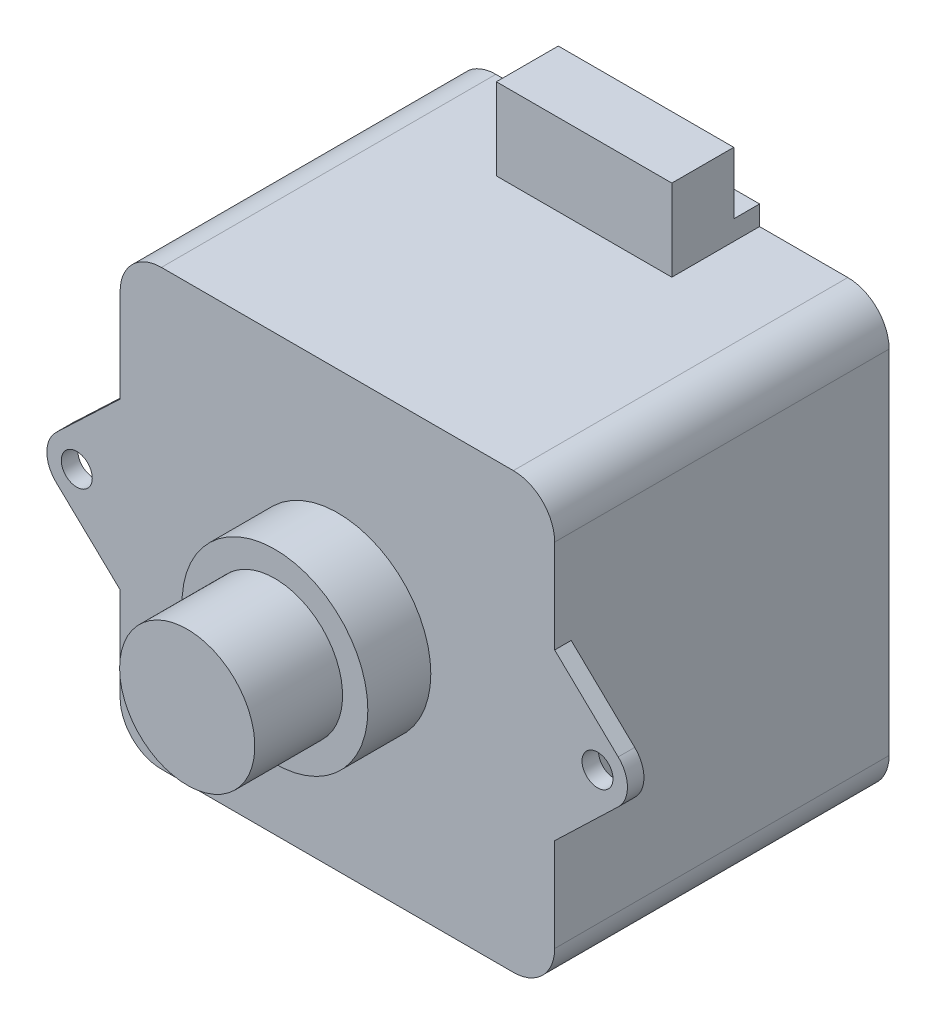
from build123d import *

# Parameters (mm, degrees)
SKETCH1_W           = 42.1
SKETCH1_H           = 42.1
BOSS_EXTRUDE1_DEPTH = 32.4
SKETCH2_W           = 17
SKETCH2_H           = 8.5
BOSS_EXTRUDE2_DEPTH = 7.9
BOSS_EXTRUDE3_DEPTH = 7.15
BOSS_EXTRUDE4_DEPTH = 7.2
SKETCH6_R           = 1.5
CUT_EXTRUDE1_DEPTH  = 7.2
CUT_EXTRUDE2_DEPTH  = 7.2
SKETCH9_R           = 6.55
BOSS_EXTRUDE5_DEPTH = 14.6
SKETCH11_R          = 9
BOSS_EXTRUDE6_DEPTH = 6.1
SKETCH12_W          = 17
SKETCH12_H          = 2.5
CUT_EXTRUDE3_DEPTH  = 6
CUT_EXTRUDE4_DEPTH  = 40


with BuildPart() as part:
    # Sketch1 → Boss-Extrude1 (new body)
    with BuildSketch(Plane.XY):
        with Locations((-21.05, 21.05)):
            Rectangle(SKETCH1_W, SKETCH1_H)
    extrude(amount=BOSS_EXTRUDE1_DEPTH)

    # Sketch2 → Boss-Extrude2 (add)
    with BuildSketch(Plane(origin=(0, 42.1, 0), x_dir=(1, 0, 0), z_dir=(0, 1, 0))):
        with Locations((-21.05, -4.25)):
            Rectangle(SKETCH2_W, SKETCH2_H)
    extrude(amount=BOSS_EXTRUDE2_DEPTH)

    # Sketch3 → Boss-Extrude3 (add)
    with BuildSketch(Plane(origin=(0, 0, 0), x_dir=(0, 0, -1), z_dir=(1, 0, 0))):
        Polygon((-32.4, 21.05), (-32.4, 29.05), (-30.8, 29.05), (-30.8, 21.05), (-30.8, 13.05), (-32.4, 13.05), align=None)
    extrude(amount=BOSS_EXTRUDE3_DEPTH)

    # Sketch4 → Boss-Extrude4 (add)
    with BuildSketch(Plane.ZY.offset(42.1)):
        Polygon((32.4, 21.05), (32.4, 29.05), (30.8, 29.05), (30.8, 21.05), (30.8, 13.05), (32.4, 13.05), align=None)
    extrude(amount=BOSS_EXTRUDE4_DEPTH)

    # Sketch6 → Cut-Extrude1 (cut)
    with BuildSketch(Plane.XY.offset(32.4)):
        with Locations((-46.3, 21.060702299)):
            Circle(SKETCH6_R)
        with Locations((4.15, 21.060702299)):
            Circle(SKETCH6_R)
    extrude(amount=-CUT_EXTRUDE1_DEPTH, mode=Mode.SUBTRACT)

    # Sketch7 → Cut-Extrude2 (cut)
    with BuildSketch(Plane.XY.offset(32.4)):
        with BuildLine():
            Line((-42.1, 29.05), (-48.297247635, 23.163320163))
            ThreePointArc((-48.297247635, 23.163320163), (-49.19999881, 21.063329654), (-48.301054234, 18.961706835))
            Line((-48.301054234, 18.961706835), (-42.1, 13.05))
            Line((-42.1, 13.05), (-49.3, 13.05))
            Line((-49.3, 13.05), (-49.3, 29.05))
            Line((-49.3, 29.05), (-42.1, 29.05))
        make_face()
        with BuildLine():
            Line((0, 29.05), (6.155732332, 23.155227976))
            ThreePointArc((6.155732332, 23.155227976), (7.049998812, 21.063327019), (6.159520454, 18.969810731))
            Line((6.159520454, 18.969810731), (0, 13.05))
            Line((0, 13.05), (7.15, 13.05))
            Line((7.15, 13.05), (7.15, 29.05))
            Line((7.15, 29.05), (0, 29.05))
        make_face()
    extrude(amount=-CUT_EXTRUDE2_DEPTH, mode=Mode.SUBTRACT)

    # Sketch9 → Boss-Extrude5 (add)
    with BuildSketch(Plane.XY.offset(32.4)):
        with Locations(Location((-21, 21.05, 0), (0, 0, 180))):
            Circle(SKETCH9_R)
    extrude(amount=BOSS_EXTRUDE5_DEPTH)

    # Sketch11 → Boss-Extrude6 (add)
    with BuildSketch(Plane.XY.offset(32.4)):
        with Locations((-21, 21.05)):
            Circle(SKETCH11_R)
    extrude(amount=BOSS_EXTRUDE6_DEPTH)

    # Sketch12 → Cut-Extrude3 (cut)
    with BuildSketch(Plane(origin=(0, 50, 0), x_dir=(1, 0, 0), z_dir=(0, 1, 0))):
        with Locations((-21.05, -1.25)):
            Rectangle(SKETCH12_W, SKETCH12_H)
    extrude(amount=-CUT_EXTRUDE3_DEPTH, mode=Mode.SUBTRACT)

    # Sketch13 → Cut-Extrude4 (cut)
    with BuildSketch(Plane(origin=(0, 0, 0), x_dir=(-1, 0, 0), z_dir=(0, 0, -1))):
        with BuildLine():
            Line((0, 0), (0, 4))
            ThreePointArc((0, 4), (1.171572875, 1.171572875), (4, 0))
            Line((4, 0), (0, 0))
        make_face()
        with BuildLine():
            Line((38.1, 0), (42.1, 0))
            Line((42.1, 0), (42.1, 4))
            ThreePointArc((42.1, 4), (40.928427125, 1.171572875), (38.1, 0))
        make_face()
        with BuildLine():
            Line((38.1, 42.1), (42.1, 42.1))
            Line((42.1, 42.1), (42.1, 38.1))
            ThreePointArc((42.1, 38.1), (40.928427125, 40.928427125), (38.1, 42.1))
        make_face()
        with BuildLine():
            Line((4, 42.1), (0, 42.1))
            Line((0, 42.1), (0, 38.1))
            ThreePointArc((0, 38.1), (1.171572875, 40.928427125), (4, 42.1))
        make_face()
    extrude(amount=-CUT_EXTRUDE4_DEPTH, mode=Mode.SUBTRACT)


solid = part.part
